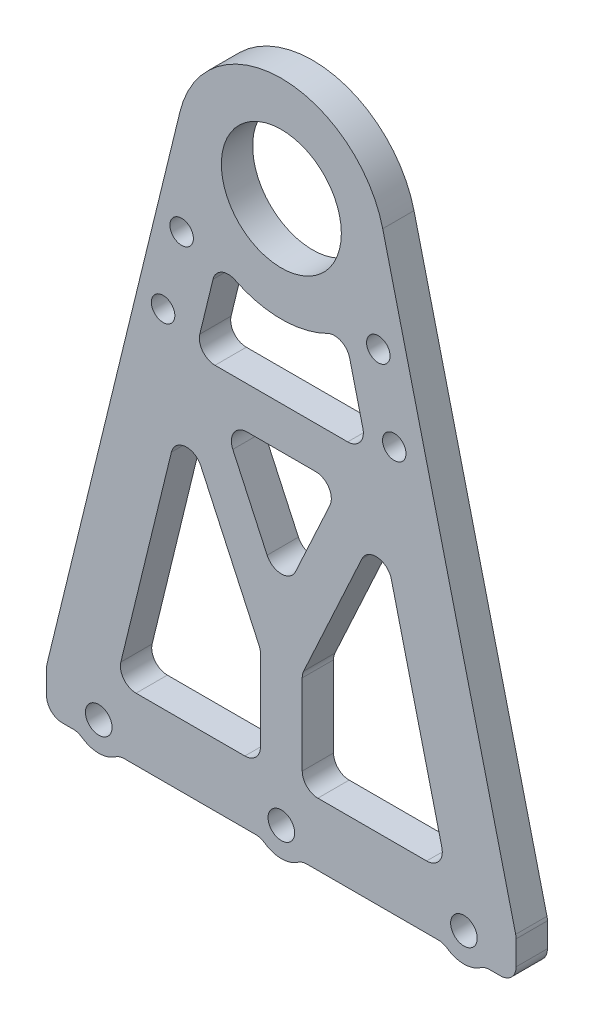
from build123d import *

# Parameters (mm, degrees)
SKETCH_1_R                   = 20
SKETCH_1_R_2                 = 11.5
EXTRUDE_1_DEPTH              = 6
SKETCH_5_W                   = 90
SKETCH_5_H                   = 8
EXTRUDE_2_DEPTH              = 6
SKETCH_6_R                   = 2.1
CUT_EXTRUDE_1_DEPTH          = 129.300428682
HOLE_WIZARD_M4_1_D           = 4.5
HOLE_WIZARD_M4_1_DEPTH       = 11.4
HOLE_WIZARD_M4_1_CSINK_D     = 8.96
HOLE_WIZARD_M4_1_CSINK_ANGLE = 90
HOLE_WIZARD_M4_1_TIP         = 1.351936393
SKETCH_10_R                  = 2.55
CUT_EXTRUDE_2_DEPTH          = 129.300428682
EXTRUDE_4_DEPTH              = 6
CUT_EXTRUDE_3_DEPTH          = 129.300428682
FILLET_1_R                   = 3


with BuildPart() as part:
    # 草图1 → 凸台-拉伸1 (new body)
    # profile 1 of 3: a face of its own
    with BuildSketch(Plane.XY):
        with Locations((0, 100)):
            Circle(SKETCH_1_R)
        with Locations((0, 100)):
            Circle(SKETCH_1_R_2, mode=Mode.SUBTRACT)
    # profile 2 of 3: a face of its own
    with BuildSketch(Plane.XY):
        with BuildLine():
            Line((-19.429404285, 104.743231928), (-45, 0))
            Line((-45, 0), (45, 0))
            Line((45, 0), (19.429404285, 104.743231928))
            ThreePointArc((19.429404285, 104.743231928), (19.856838692, 102.388714539), (20, 100))
            ThreePointArc((20, 100), (-2.388714539, 80.143161308), (-19.429404285, 104.743231928))
        make_face()
    # profile 3 of 3: a face of its own
    with BuildSketch(Plane.XY):
        with BuildLine():
            Line((-19.429404285, 104.743231928), (-45, 0))
            Line((-45, 0), (45, 0))
            Line((45, 0), (19.429404285, 104.743231928))
            ThreePointArc((19.429404285, 104.743231928), (19.856838692, 102.388714539), (20, 100))
            ThreePointArc((20, 100), (-2.388714539, 80.143161308), (-19.429404285, 104.743231928))
        make_face()
    extrude(amount=EXTRUDE_1_DEPTH)

    # 草图5 → 凸台-拉伸2 (add)
    with BuildSketch(Plane.XY.offset(6)):
        with Locations((0, -4)):
            Rectangle(SKETCH_5_W, SKETCH_5_H)
    extrude(amount=-EXTRUDE_2_DEPTH)

    # 草图6 → 切除-拉伸1 (cut, through all)
    with BuildSketch(Plane.XY.offset(6)):
        with Locations((-22.667866245, 70.382755655)):
            Circle(SKETCH_6_R)
        with Locations((21.643312936, 69.625992562)):
            Circle(SKETCH_6_R)
        with Locations((18.58555253, 84.311022398)):
            Circle(SKETCH_6_R)
        with Locations((-19.110442299, 84.954808869)):
            Circle(SKETCH_6_R)
    extrude(amount=-CUT_EXTRUDE_1_DEPTH, mode=Mode.SUBTRACT)

    # M4 六角凹锥坑螺钉的锥形沉头孔1
    with Locations(Plane(origin=(0, 0, 0), x_dir=(-1, 0, 0), z_dir=(0, 0, -1))):
        with Locations((22.667866245, 70.382755655), (19.110442299, 84.954808869), (-18.58555253, 84.311022398), (-21.643312936, 69.625992562)):
            CounterSinkHole(HOLE_WIZARD_M4_1_D / 2, HOLE_WIZARD_M4_1_CSINK_D / 2, depth=HOLE_WIZARD_M4_1_DEPTH, counter_sink_angle=HOLE_WIZARD_M4_1_CSINK_ANGLE)
            with Locations((0, 0, -(HOLE_WIZARD_M4_1_DEPTH + HOLE_WIZARD_M4_1_TIP / 2))):  # 118° drill point
                Cone(0, HOLE_WIZARD_M4_1_D / 2, HOLE_WIZARD_M4_1_TIP, mode=Mode.SUBTRACT)

    # 草图10 → 切除-拉伸2 (cut, through all)
    with BuildSketch(Plane(origin=(0, 0, 0), x_dir=(-1, 0, 0), z_dir=(0, 0, -1))):
        with Locations((-35, -4)):
            Circle(SKETCH_10_R)
        with Locations((0, -4)):
            Circle(SKETCH_10_R)
        with Locations((35, -4)):
            Circle(SKETCH_10_R)
    extrude(amount=-CUT_EXTRUDE_2_DEPTH, mode=Mode.SUBTRACT)

    # 草图11 → 凸台-拉伸4 (add)
    with BuildSketch(Plane(origin=(0, 0, 0), x_dir=(-1, 0, 0), z_dir=(0, 0, -1))):
        with BuildLine():
            Line((-31.152598279, -8), (-38.847401721, -8))
            ThreePointArc((-38.847401721, -8), (-35, -9.55), (-31.152598279, -8))
        make_face()
        with BuildLine():
            Line((3.847401721, -8), (-3.847401721, -8))
            ThreePointArc((-3.847401721, -8), (0, -9.55), (3.847401721, -8))
        make_face()
        with BuildLine():
            ThreePointArc((31.152598279, -8), (35, -9.55), (38.847401721, -8))
            Line((38.847401721, -8), (31.152598279, -8))
        make_face()
    extrude(amount=-EXTRUDE_4_DEPTH)

    # 草图9 → 切除-拉伸3 (cut, through all)
    with BuildSketch(Plane(origin=(0, 0, 0), x_dir=(-1, 0, 0), z_dir=(0, 0, -1))):
        with BuildLine():
            ThreePointArc((12.119005584, 84.089949602), (0, 80), (-12.119005584, 84.089949602))
            Line((-12.119005584, 84.089949602), (-16.535241166, 66))
            Line((-16.535241166, 66), (16.535241166, 66))
            Line((16.535241166, 66), (12.119005584, 84.089949602))
        make_face()
        Polygon((11.264099529, 58), (-11.264099529, 58), (0, 33.55721992), align=None)
        Polygon((-4, 23.122667902), (-19.036946629, 55.752420381), (-31.671082453, 4), (-4, 4), align=None)
        Polygon((31.671082453, 4), (19.036946629, 55.752420381), (4, 23.122667902), (4, 4), align=None)
    extrude(amount=-CUT_EXTRUDE_3_DEPTH, mode=Mode.SUBTRACT)

    # 圆角1
    fillet_1_edges = [part.edges().sort_by_distance(p)[0] for p in [
        (45, 0, 3),
        (-45, 0, 3),
        (31.152598279, -8, 3),
        (38.847401721, -8, 3),
        (-3.847401721, -8, 3),
        (3.847401721, -8, 3),
        (-38.847401721, -8, 3),
        (-31.152598279, -8, 3),
        (12.119005584, 84.089949602, 3),
        (-12.119005584, 84.089949602, 3),
        (-16.535241166, 66, 3),
        (16.535241166, 66, 3),
        (-4, 23.122667902, 3),
        (-19.036946629, 55.752420381, 3),
        (-31.671082453, 4, 3),
        (-4, 4, 3),
        (11.264099529, 58, 3),
        (-11.264099529, 58, 3),
        (0, 33.55721992, 3),
        (4, 23.122667902, 3),
        (4, 4, 3),
        (31.671082453, 4, 3),
        (19.036946629, 55.752420381, 3),
        (-45, -8, 3),
        (45, -8, 3),
    ]]
    fillet(fillet_1_edges, radius=FILLET_1_R)


solid = part.part
